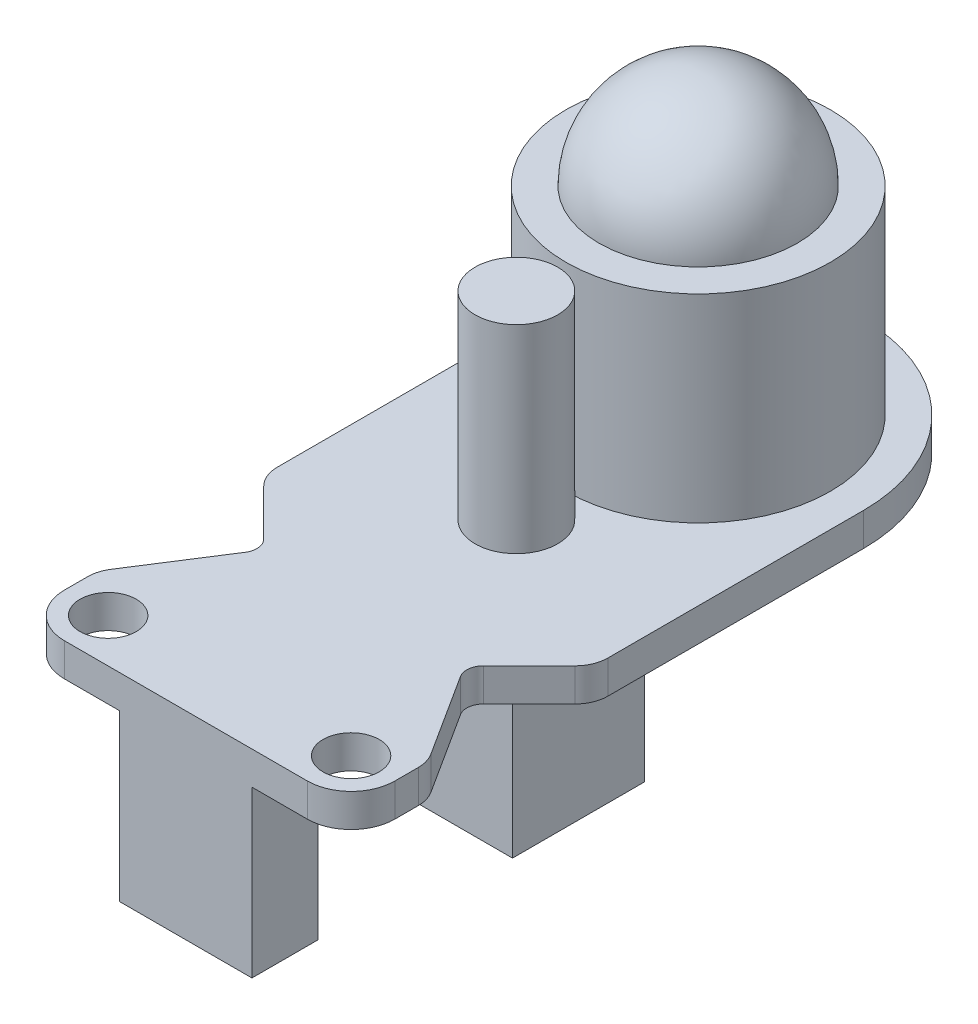
from build123d import *

# Parameters (mm, degrees)
SKETCH_1_R      = 1.7
EXTRUDE_1_DEPTH = 2
FILLET_1_R      = 2
SKETCH_3_R      = 8
SKETCH_3_R_2    = 2.5
EXTRUDE_2_DEPTH = 12
SKETCH_5_W      = 8
SKETCH_5_H      = 8
EXTRUDE_3_DEPTH = 12
SKETCH_6_W      = 8
SKETCH_6_H      = 4
EXTRUDE_4_DEPTH = 10


with BuildPart() as part:
    # 草图1 → 凸台-拉伸1 (new body)
    with BuildSketch(Plane(origin=(0, 0, 0), x_dir=(1, 0, 0), z_dir=(0, 1, 0))):
        with BuildLine():
            Line((10, 28.35), (10, 12.064213562))
            Line((10, 12.064213562), (6.642893219, 8.707106781))
            ThreePointArc((6.642893219, 8.707106781), (6.355850084, 8.108009006), (6.507537143, 7.461245571))
            Line((6.507537143, 7.461245571), (10, 2))
            Line((10, 2), (10, 0))
            ThreePointArc((10, 0), (9.22383297, -1.87383297), (7.35, -2.65))
            Line((7.35, -2.65), (-7.35, -2.65))
            ThreePointArc((-7.35, -2.65), (-9.22383297, -1.87383297), (-10, 0))
            Line((-10, 0), (-10, 2))
            Line((-10, 2), (-6.507537143, 7.461245571))
            ThreePointArc((-6.507537143, 7.461245571), (-6.355850084, 8.108009006), (-6.642893219, 8.707106781))
            Line((-6.642893219, 8.707106781), (-10, 12.064213562))
            Line((-10, 12.064213562), (-10, 28.35))
            ThreePointArc((-10, 28.35), (0, 38.35), (10, 28.35))
        make_face()
        with Locations(Location((7.35, 0, 0), (0, 0, 270))):
            Circle(SKETCH_1_R, mode=Mode.SUBTRACT)
        with Locations(Location((-7.35, 0, 0), (0, 0, 90))):
            Circle(SKETCH_1_R, mode=Mode.SUBTRACT)
    extrude(amount=EXTRUDE_1_DEPTH)

    # 圆角1
    fillet_1_edges = [part.edges().sort_by_distance(p)[0] for p in [
        (-10, 1, -2),
        (-10, 1, -12.064213562),
        (10, 1, -12.064213562),
        (10, 1, -2),
    ]]
    fillet(fillet_1_edges, radius=FILLET_1_R)

    # 草图3 → 凸台-拉伸2 (add)
    with BuildSketch(Plane(origin=(0, 2, 0), x_dir=(1, 0, 0), z_dir=(0, 1, 0))):
        with Locations(Location((0, 28.35, 0), (0, 0, 90))):
            Circle(SKETCH_3_R)
        with Locations(Location((0, 17.35, 0), (0, 0, 90))):
            Circle(SKETCH_3_R_2)
    extrude(amount=EXTRUDE_2_DEPTH)

    # 草图4 → 旋转1 (revolve)
    with BuildSketch(Plane(origin=(0, 14, 0), x_dir=(1, 0, 0), z_dir=(0, 1, 0))):
        with BuildLine():
            Line((0, 34.35), (0, 22.35))
            ThreePointArc((0, 22.35), (6, 28.35), (0, 34.35))
        make_face()
    revolve(axis=Axis((0, 14, -36.05355047), (0, 0, 1)))

    # 草图5 → 凸台-拉伸3 (add)
    with BuildSketch(Plane.XZ):
        with Locations((-0.398314742, -17.513469077)):
            Rectangle(SKETCH_5_W, SKETCH_5_H)
    extrude(amount=EXTRUDE_3_DEPTH)

    # 草图6 → 凸台-拉伸4 (add)
    with BuildSketch(Plane.XZ):
        with Locations((0, 0.65)):
            Rectangle(SKETCH_6_W, SKETCH_6_H)
    extrude(amount=EXTRUDE_4_DEPTH)


solid = part.part
